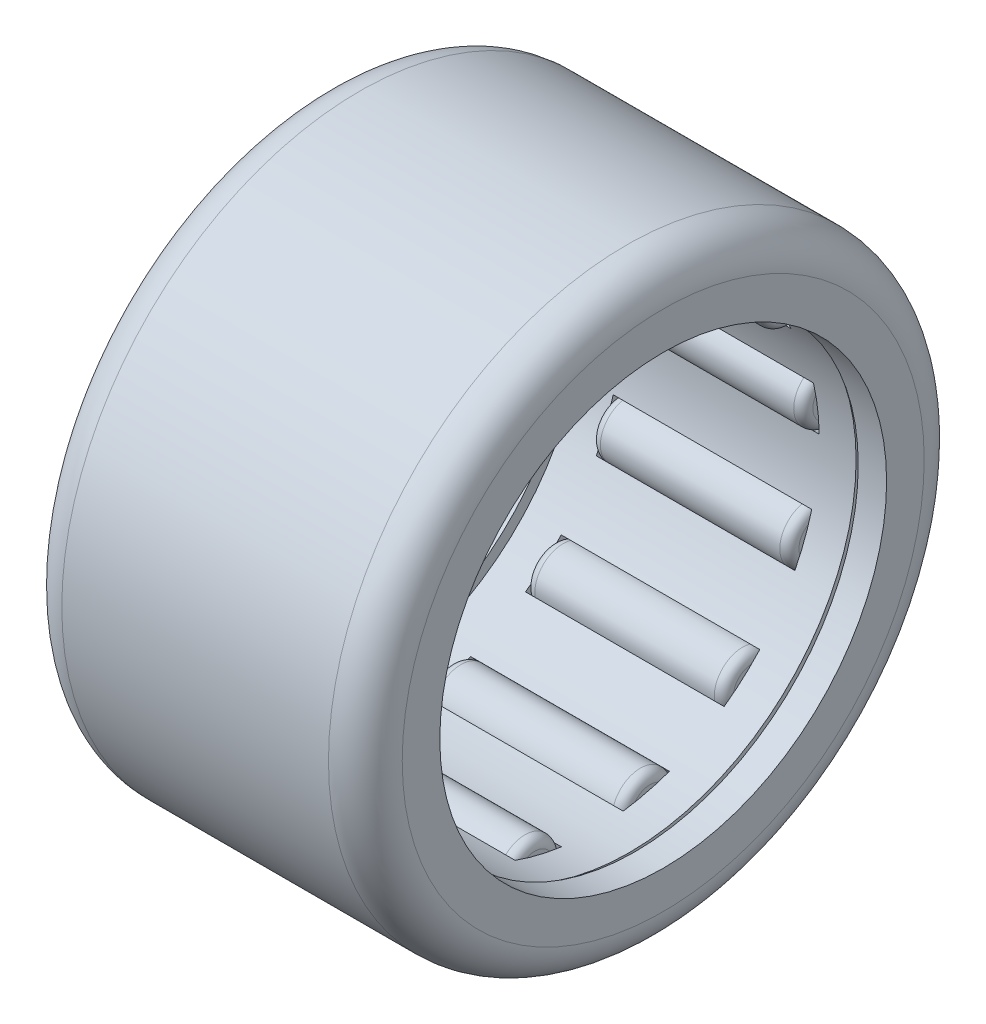
from build123d import *

# Parameters (mm, degrees)
SKETCH_1_W               = 9.6
SKETCH_1_H               = 1
SKETCH_3_W               = 7
SKETCH_3_H               = 1
PATTERN_CIRCULAR_2_COUNT = 13
PATTERN_CIRCULAR_4_COUNT = 13


with BuildPart() as part:
    # ｽｹｯﾁ1 → 回転1 (revolve)
    with BuildSketch(Plane.XY):
        with BuildLine():
            Line((6, 7.875), (5, 7.875))
            Line((5, 7.875), (5, 9.2))
            ThreePointArc((5, 9.2), (4.912132034, 9.412132034), (4.7, 9.5))
            Line((4.7, 9.5), (-4.7, 9.5))
            ThreePointArc((-4.7, 9.5), (-4.912132034, 9.412132034), (-5, 9.2))
            Line((-5, 9.2), (-5, 7.875))
            Line((-5, 7.875), (-6, 7.875))
            Line((-6, 7.875), (-6, 9.2))
            ThreePointArc((-6, 9.2), (-5.619238816, 10.119238816), (-4.7, 10.5))
            Line((-4.7, 10.5), (4.7, 10.5))
            ThreePointArc((4.7, 10.5), (5.619238816, 10.119238816), (6, 9.2))
            Line((6, 9.2), (6, 7.875))
        make_face()
        with Locations((0, 8.5)):
            Rectangle(SKETCH_1_W, SKETCH_1_H)
    revolve(axis=Axis((0, 0, 0), (1, 0, 0)))

    # ｽｹｯﾁ3 → ｶｯﾄ - 回転1 (revolve, cut)
    with BuildSketch(Plane.XY):
        with Locations((0, 9)):
            Rectangle(SKETCH_3_W, SKETCH_3_H)
    cut_revolve_1 = revolve(axis=Axis((-8.222336739, 8.5, 0), (1, 0, 0)), mode=Mode.SUBTRACT)

    # 円形ﾊﾟﾀｰﾝ2: ｶｯﾄ - 回転1 ×13 about axis
    pattern_circular_2_axis = Axis((0, 0, 0), (-1, 0, 0))
    for i in range(1, PATTERN_CIRCULAR_2_COUNT):
        add(cut_revolve_1.rotate(pattern_circular_2_axis, i * 360 / PATTERN_CIRCULAR_2_COUNT), mode=Mode.SUBTRACT)


with BuildPart() as body_2:
    # ｽｹｯﾁ3<4> → 回転2 (revolve)
    with BuildSketch(Plane.XY):
        with BuildLine():
            Line((-3.5, 8.5), (3.5, 8.5))
            Line((3.5, 8.5), (3.5, 9.1625))
            ThreePointArc((3.5, 9.1625), (3.401148539, 9.401148539), (3.1625, 9.5))
            Line((3.1625, 9.5), (-3.1625, 9.5))
            ThreePointArc((-3.1625, 9.5), (-3.401148539, 9.401148539), (-3.5, 9.1625))
            Line((-3.5, 9.1625), (-3.5, 8.5))
        make_face()
    revolve(axis=Axis((-8.222336739, 8.5, 0), (1, 0, 0)))


with BuildPart() as pattern_circular_4_1:
    # 円形ﾊﾟﾀｰﾝ4: pattern copy
    add(body_2.part.rotate(Axis((0, 0, 0), (-1, 0, 0)), 1 * 360 / PATTERN_CIRCULAR_4_COUNT))


with BuildPart() as pattern_circular_4_2:
    # 円形ﾊﾟﾀｰﾝ4: pattern copy
    add(body_2.part.rotate(Axis((0, 0, 0), (-1, 0, 0)), 2 * 360 / PATTERN_CIRCULAR_4_COUNT))


with BuildPart() as pattern_circular_4_3:
    # 円形ﾊﾟﾀｰﾝ4: pattern copy
    add(body_2.part.rotate(Axis((0, 0, 0), (-1, 0, 0)), 3 * 360 / PATTERN_CIRCULAR_4_COUNT))


with BuildPart() as pattern_circular_4_4:
    # 円形ﾊﾟﾀｰﾝ4: pattern copy
    add(body_2.part.rotate(Axis((0, 0, 0), (-1, 0, 0)), 4 * 360 / PATTERN_CIRCULAR_4_COUNT))


with BuildPart() as pattern_circular_4_5:
    # 円形ﾊﾟﾀｰﾝ4: pattern copy
    add(body_2.part.rotate(Axis((0, 0, 0), (-1, 0, 0)), 5 * 360 / PATTERN_CIRCULAR_4_COUNT))


with BuildPart() as pattern_circular_4_6:
    # 円形ﾊﾟﾀｰﾝ4: pattern copy
    add(body_2.part.rotate(Axis((0, 0, 0), (-1, 0, 0)), 6 * 360 / PATTERN_CIRCULAR_4_COUNT))


with BuildPart() as pattern_circular_4_7:
    # 円形ﾊﾟﾀｰﾝ4: pattern copy
    add(body_2.part.rotate(Axis((0, 0, 0), (-1, 0, 0)), 7 * 360 / PATTERN_CIRCULAR_4_COUNT))


with BuildPart() as pattern_circular_4_8:
    # 円形ﾊﾟﾀｰﾝ4: pattern copy
    add(body_2.part.rotate(Axis((0, 0, 0), (-1, 0, 0)), 8 * 360 / PATTERN_CIRCULAR_4_COUNT))


with BuildPart() as pattern_circular_4_9:
    # 円形ﾊﾟﾀｰﾝ4: pattern copy
    add(body_2.part.rotate(Axis((0, 0, 0), (-1, 0, 0)), 9 * 360 / PATTERN_CIRCULAR_4_COUNT))


with BuildPart() as pattern_circular_4_10:
    # 円形ﾊﾟﾀｰﾝ4: pattern copy
    add(body_2.part.rotate(Axis((0, 0, 0), (-1, 0, 0)), 10 * 360 / PATTERN_CIRCULAR_4_COUNT))


with BuildPart() as pattern_circular_4_11:
    # 円形ﾊﾟﾀｰﾝ4: pattern copy
    add(body_2.part.rotate(Axis((0, 0, 0), (-1, 0, 0)), 11 * 360 / PATTERN_CIRCULAR_4_COUNT))


with BuildPart() as pattern_circular_4_12:
    # 円形ﾊﾟﾀｰﾝ4: pattern copy
    add(body_2.part.rotate(Axis((0, 0, 0), (-1, 0, 0)), 12 * 360 / PATTERN_CIRCULAR_4_COUNT))


solid = Compound([part.part, body_2.part, pattern_circular_4_1.part, pattern_circular_4_2.part, pattern_circular_4_3.part, pattern_circular_4_4.part, pattern_circular_4_5.part, pattern_circular_4_6.part, pattern_circular_4_7.part, pattern_circular_4_8.part, pattern_circular_4_9.part, pattern_circular_4_10.part, pattern_circular_4_11.part, pattern_circular_4_12.part])
